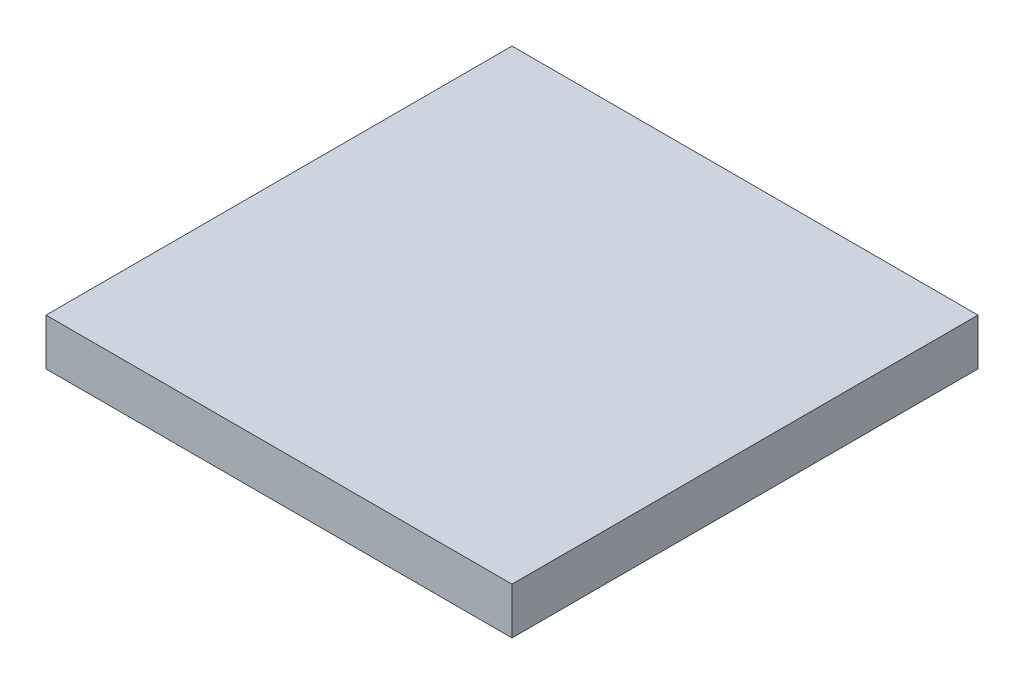
from build123d import *

# Parameters (mm, degrees)
SKETCH1_W           = 25.4
SKETCH1_H           = 25.4
BOSS_EXTRUDE1_DEPTH = 2.54


with BuildPart() as part:
    # Sketch1 → Boss-Extrude1 (new body)
    with BuildSketch(Plane(origin=(0, 0, 0), x_dir=(1, 0, 0), z_dir=(0, 1, 0))):
        with Locations((12.7, 12.7)):
            Rectangle(SKETCH1_W, SKETCH1_H)
    extrude(amount=BOSS_EXTRUDE1_DEPTH)


solid = part.part
